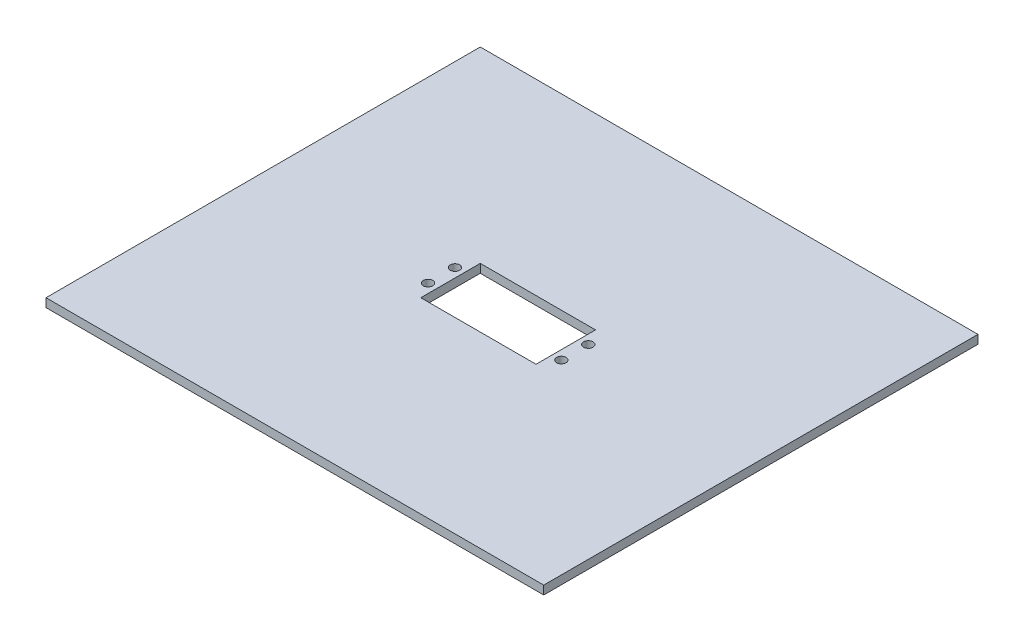
from build123d import *

# Parameters (mm, degrees)
SKETCH1_W           = 184.839561026
SKETCH1_H           = 161.279122052
SKETCH1_R           = 1.75
SKETCH1_W_2         = 42.8
SKETCH1_H_2         = 22.1
BOSS_EXTRUDE1_DEPTH = 3.2


with BuildPart() as part:
    # Sketch1 → Boss-Extrude1 (new body)
    with BuildSketch(Plane(origin=(0, 0, 0), x_dir=(1, 0, 0), z_dir=(0, 1, 0))):
        with Locations((11.780219487, 0)):
            Rectangle(SKETCH1_W, SKETCH1_H)
        with Locations(Location((-14.4, 5, 0), (0, 0, 270))):
            Circle(SKETCH1_R, mode=Mode.SUBTRACT)
        with Locations(Location((-14.4, -5, 0), (0, 0, 270))):
            Circle(SKETCH1_R, mode=Mode.SUBTRACT)
        with Locations(Location((35.1, -5, 0), (0, 0, 270))):
            Circle(SKETCH1_R, mode=Mode.SUBTRACT)
        with Locations(Location((35.1, 5, 0), (0, 0, 270))):
            Circle(SKETCH1_R, mode=Mode.SUBTRACT)
        with Locations((10.35, 0)):
            Rectangle(SKETCH1_W_2, SKETCH1_H_2, mode=Mode.SUBTRACT)
    extrude(amount=-BOSS_EXTRUDE1_DEPTH)


solid = part.part
